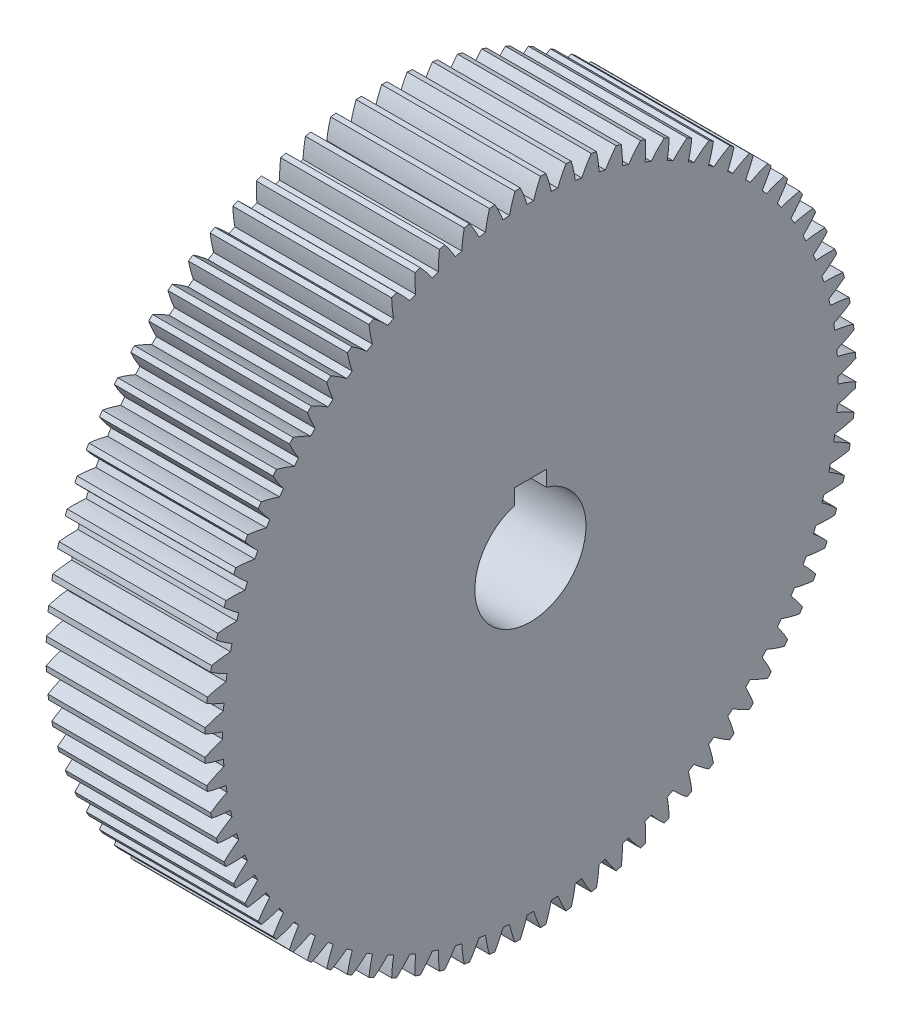
from build123d import *

# Parameters (mm, degrees)
BASPROSKE_W     = 40
BASPROSKE_H     = 82
TOOTHCUT_DEPTH  = 123.670289802
TEETHCUTS_COUNT = 80
TEETHCUTS_ANGLE = 355.5
BORSKE_R        = 14
BORE_DEPTH      = 50.0000508
KEYSKE_W        = 8
KEYSKE_H        = 17.3
KEYWAY_DEPTH    = 50.0000508


with BuildPart() as part:
    # BasProSke → Base-Revolve (revolve)
    with BuildSketch(Plane(origin=(0, 0, 0), x_dir=(1, 0, 0), z_dir=(0, 1, 0)), mode=Mode.PRIVATE) as base_revolve_sk:
        with Locations((20, 41)):
            Rectangle(BASPROSKE_W, BASPROSKE_H)
    revolve(base_revolve_sk.sketch.rotate(Axis((-10, 0, 0), (1, 0, 0)), 180), axis=Axis((-10, 0, 0), (1, 0, 0)))

    # TooCutSke → ToothCut (cut, through all)
    with BuildSketch(Plane(origin=(0, 0, 0), x_dir=(0, 0, -1), z_dir=(1, 0, 0))):
        with BuildLine():
            ThreePointArc((0.826151948, 77.494596418), (0, 77.499), (-0.826151948, 77.494596418))
            ThreePointArc((-0.826151948, 77.494596418), (-1.606395028, 79.772645896), (-2.555728345, 81.985574937))
            ThreePointArc((-2.555728345, 81.985574937), (0, 82.0254), (2.555728345, 81.985574937))
            ThreePointArc((2.555728345, 81.985574937), (1.606395028, 79.772645896), (0.826151948, 77.494596418))
        make_face()
    toothcut = extrude(amount=TOOTHCUT_DEPTH, mode=Mode.SUBTRACT)

    # TeethCuts: ToothCut ×80 about axis
    teethcuts_axis = Axis((-10, 0, 0), (1, 0, 0))
    for i in range(1, TEETHCUTS_COUNT):
        add(toothcut.rotate(teethcuts_axis, i * TEETHCUTS_ANGLE / (TEETHCUTS_COUNT - 1)), mode=Mode.SUBTRACT)

    # BorSke → Bore (cut, symmetric)
    with BuildSketch(Plane(origin=(0, 0, 0), x_dir=(0, 0, -1), z_dir=(1, 0, 0))):
        with Locations(Location((0, 0, 0), (0, 0, 180))):
            Circle(BORSKE_R)
    extrude(amount=BORE_DEPTH, both=True, mode=Mode.SUBTRACT)

    # KeySke → Keyway (cut, symmetric)
    with BuildSketch(Plane(origin=(0, 0, 0), x_dir=(0, 0, -1), z_dir=(1, 0, 0))):
        with Locations((0, 8.65)):
            Rectangle(KEYSKE_W, KEYSKE_H)
    extrude(amount=KEYWAY_DEPTH, both=True, mode=Mode.SUBTRACT)


solid = part.part
